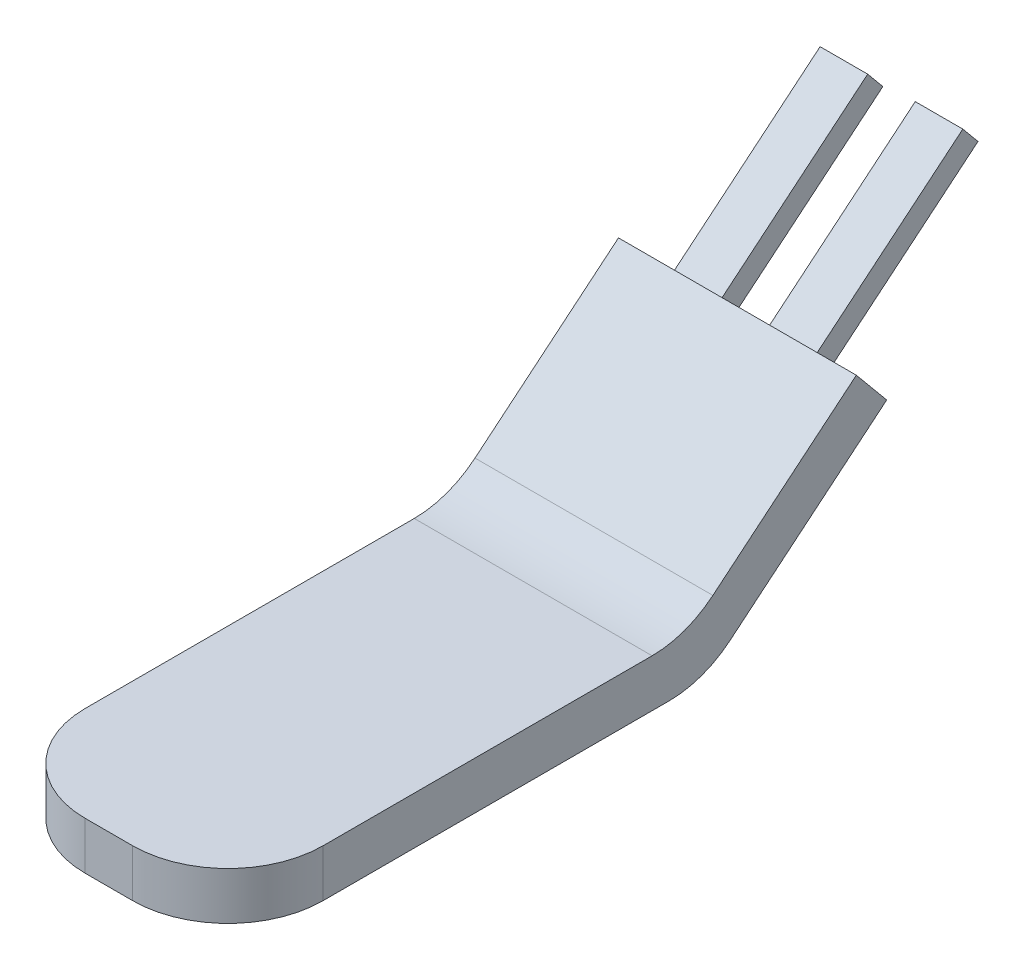
from build123d import *

# Parameters (mm, degrees)
BOSS_EXTRUDE1_DEPTH = 2.5
FILLET1_R           = 1
FILLET2_R           = 1
SKETCH3_W           = 0.5
SKETCH3_H           = 0.25
BOSS_EXTRUDE2_DEPTH = 2


with BuildPart() as part:
    # Sketch1 → Boss-Extrude1 (new body)
    with BuildSketch(Plane(origin=(0, 0, 0), x_dir=(0, 0, -1), z_dir=(1, 0, 0))):
        Polygon((0, 0), (5, 0), (6.924233249, 1.596034587), (6.605026331, 1.980881237), (4.819625854, 0.5), (0, 0.5), align=None)
    extrude(amount=BOSS_EXTRUDE1_DEPTH)

    # Fillet1
    fillet1_edges = [part.edges().sort_by_distance(p)[0] for p in [
        (2.5, 0.25, 0),
        (0, 0.25, 0),
    ]]
    fillet(fillet1_edges, radius=FILLET1_R)

    # Fillet2
    fillet2_edges = [part.edges().sort_by_distance(p)[0] for p in [
        (1.25, 0.5, -4.819625854),
        (1.25, 0, -5),
    ]]
    fillet(fillet2_edges, radius=FILLET2_R)

    # Sketch3 → Boss-Extrude2 (add)
    with BuildSketch(Plane(origin=(0, 4.052948843, -4.886372126), x_dir=(-1, 0, 0), z_dir=(0, 0.6384138349157521, -0.7696932995603917))):
        with Locations((-1.75, -2.942069175)):
            Rectangle(SKETCH3_W, SKETCH3_H)
        with Locations((-0.75, -2.942069175)):
            Rectangle(SKETCH3_W, SKETCH3_H)
    extrude(amount=BOSS_EXTRUDE2_DEPTH)


solid = part.part
